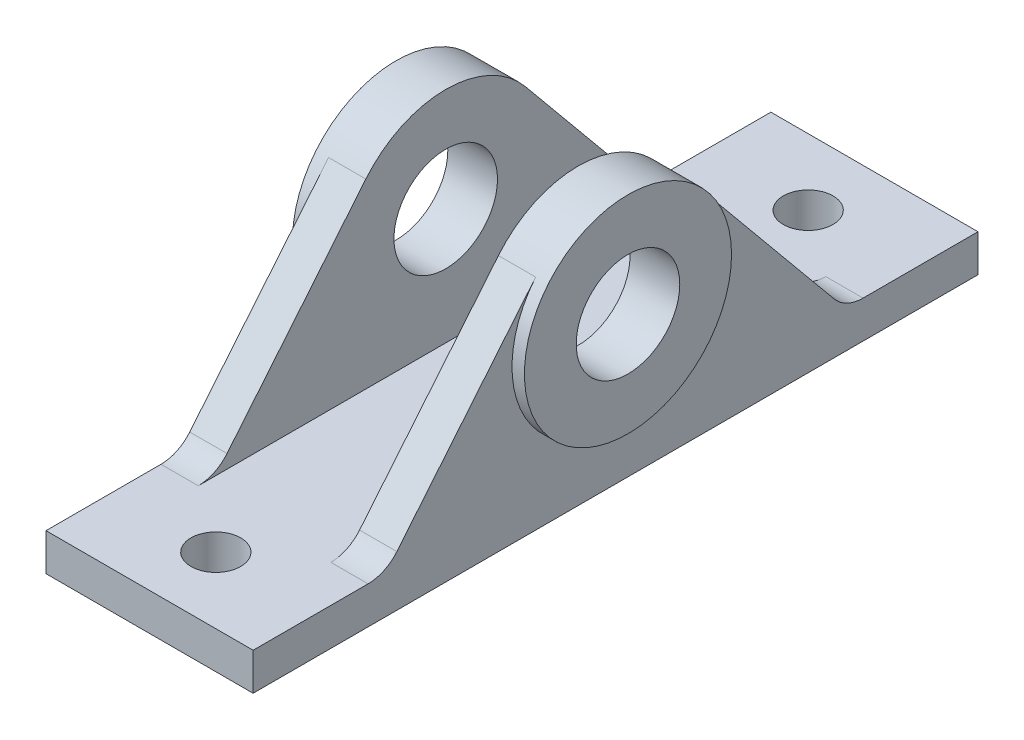
from build123d import *

# Parameters (mm, degrees)
SKETCH1_W            = 50
SKETCH1_H            = 175
BOSS_EXTRUDE1_DEPTH  = 9
SKETCH2_R            = 6
CUT_EXTRUDE1_DEPTH   = 92.445338864
BOSS_EXTRUDE2_DEPTH  = 9
BOSS_EXTRUDE3_START  = 3
SKETCH3_3_R          = 25
SKETCH3_3_R_2        = 12.5
BOSS_EXTRUDE3_DEPTH  = 12
FILLET1_R            = 9
FILLET1_OF_MIRROR4_R = 9


with BuildPart() as part:
    # Sketch1 → Boss-Extrude1 (new body)
    with BuildSketch(Plane(origin=(0, 0, 0), x_dir=(1, 0, 0), z_dir=(0, 1, 0))):
        Rectangle(SKETCH1_W, SKETCH1_H)
    extrude(amount=BOSS_EXTRUDE1_DEPTH)

    # Sketch2 → Cut-Extrude1 (cut, through all)
    with BuildSketch(Plane(origin=(0, 9, 0), x_dir=(1, 0, 0), z_dir=(0, 1, 0))):
        with Locations((0, -71.5)):
            Circle(SKETCH2_R)
    cut_extrude1 = extrude(amount=-CUT_EXTRUDE1_DEPTH, mode=Mode.SUBTRACT)

    # Mirror1: Cut-Extrude1 across plane
    add(cut_extrude1.mirror(Plane.XY), mode=Mode.SUBTRACT)

    # Sketch3 → Boss-Extrude2 (add)
    with BuildSketch(Plane(origin=(25, 0, 0), x_dir=(0, 0, -1), z_dir=(1, 0, 0))):
        with BuildLine():
            Line((-19.286429863, 52.90703062), (-55.5, 9))
            Line((-55.5, 9), (55.5, 9))
            Line((55.5, 9), (19.286429863, 52.90703062))
            ThreePointArc((19.286429863, 52.90703062), (0, 12), (-19.286429863, 52.90703062))
        make_face()
    boss_extrude2 = extrude(amount=-BOSS_EXTRUDE2_DEPTH)

    # Sketch3<3> → Boss-Extrude3 (add)
    with BuildSketch(Plane(origin=(25, 0, 0), x_dir=(0, 0, -1), z_dir=(1, 0, 0)).offset(BOSS_EXTRUDE3_START)):
        with Locations((0, 37)):
            Circle(SKETCH3_3_R)
        with Locations((0, 37)):
            Circle(SKETCH3_3_R_2, mode=Mode.SUBTRACT)
    boss_extrude3 = extrude(amount=-BOSS_EXTRUDE3_DEPTH)

    # Fillet1
    fillet1_edges = [part.edges().sort_by_distance(p)[0] for p in [
        (20.5, 9, -55.5),
        (20.5, 9, 55.5),
    ]]
    fillet(fillet1_edges, radius=FILLET1_R)

    # Mirror4: Boss-Extrude2, Boss-Extrude3 across plane
    add(boss_extrude2.mirror(Plane(origin=(0, 0, 0), x_dir=(0, 0, 1), z_dir=(1, 0, 0))))
    add(boss_extrude3.mirror(Plane(origin=(0, 0, 0), x_dir=(0, 0, 1), z_dir=(1, 0, 0))))

    # Fillet1 of Mirror4
    fillet1_of_mirror4_edges = [part.edges().sort_by_distance(p)[0] for p in [
        (-20.5, 9, -55.5),
        (-20.5, 9, 55.5),
    ]]
    fillet(fillet1_of_mirror4_edges, radius=FILLET1_OF_MIRROR4_R)


solid = part.part
